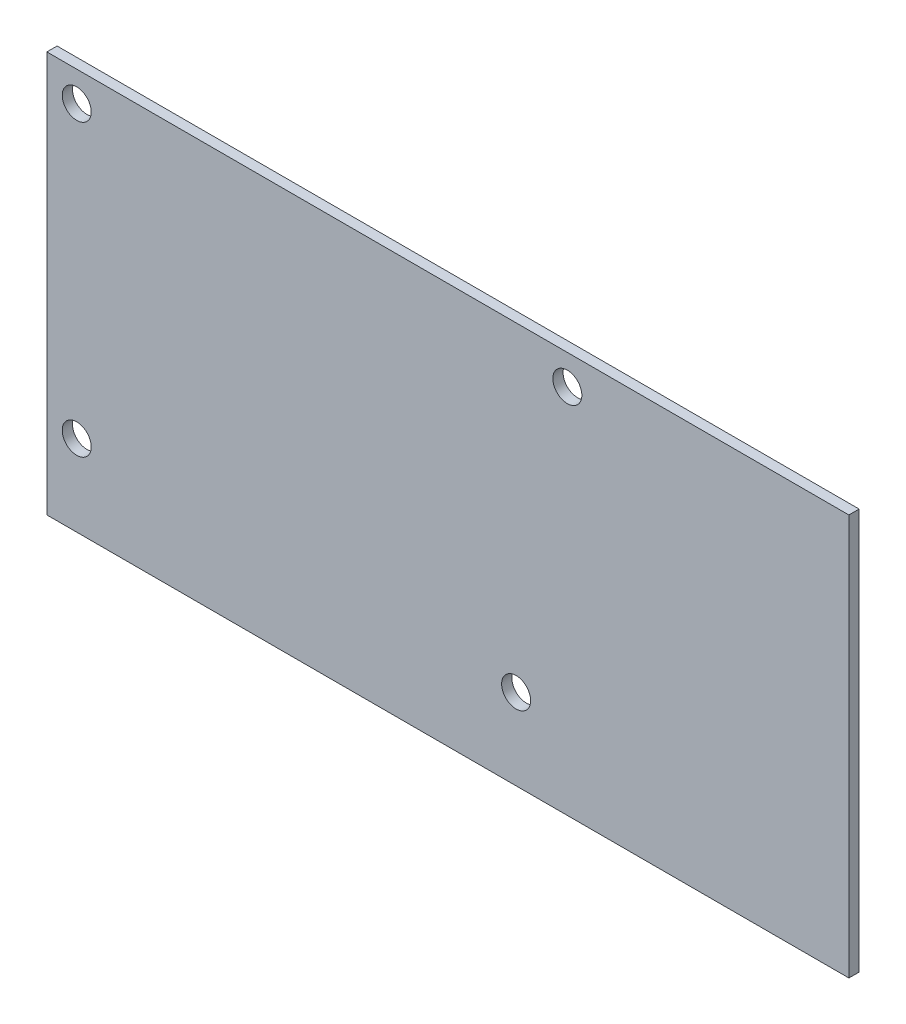
from build123d import *

# Parameters (mm, degrees)
SKETCH1_W           = 94
SKETCH1_H           = 47
BOSS_EXTRUDE1_DEPTH = 1.2
CUT_EXTRUDE1_REACH  = 54.561
SKETCH2_R           = 1.7


with BuildPart() as part:
    # Sketch1 → Boss-Extrude1 (new body)
    with BuildSketch(Plane.XY):
        Rectangle(SKETCH1_W, SKETCH1_H)
    extrude(amount=BOSS_EXTRUDE1_DEPTH)

    # Sketch2 → Cut-Extrude1 (cut, up to next)
    with BuildSketch(Plane.XY.offset(1.2), mode=Mode.PRIVATE) as cut_extrude1_sk1:
        with Locations((14, 20)):
            Circle(SKETCH2_R)
    cut_extrude1_tool1 = extrude(cut_extrude1_sk1.sketch, amount=-CUT_EXTRUDE1_REACH, mode=Mode.PRIVATE) & part.part
    # Sketch2 → Cut-Extrude1 (cut, up to next)
    with BuildSketch(Plane.XY.offset(1.2), mode=Mode.PRIVATE) as cut_extrude1_sk2:
        with Locations((8, -14)):
            Circle(SKETCH2_R)
    cut_extrude1_tool2 = extrude(cut_extrude1_sk2.sketch, amount=-CUT_EXTRUDE1_REACH, mode=Mode.PRIVATE) & part.part
    # Sketch2 → Cut-Extrude1 (cut, up to next)
    with BuildSketch(Plane.XY.offset(1.2), mode=Mode.PRIVATE) as cut_extrude1_sk3:
        with Locations((-43.5, -14)):
            Circle(SKETCH2_R)
    cut_extrude1_tool3 = extrude(cut_extrude1_sk3.sketch, amount=-CUT_EXTRUDE1_REACH, mode=Mode.PRIVATE) & part.part
    # Sketch2 → Cut-Extrude1 (cut, up to next)
    with BuildSketch(Plane.XY.offset(1.2), mode=Mode.PRIVATE) as cut_extrude1_sk4:
        with Locations((-43.5, 20)):
            Circle(SKETCH2_R)
    cut_extrude1_tool4 = extrude(cut_extrude1_sk4.sketch, amount=-CUT_EXTRUDE1_REACH, mode=Mode.PRIVATE) & part.part
    add(cut_extrude1_tool1.solids().sort_by_distance((14, 20, 1.2))[0], mode=Mode.SUBTRACT)
    add(cut_extrude1_tool2.solids().sort_by_distance((8, -14, 1.2))[0], mode=Mode.SUBTRACT)
    add(cut_extrude1_tool3.solids().sort_by_distance((-43.5, -14, 1.2))[0], mode=Mode.SUBTRACT)
    add(cut_extrude1_tool4.solids().sort_by_distance((-43.5, 20, 1.2))[0], mode=Mode.SUBTRACT)


solid = part.part
